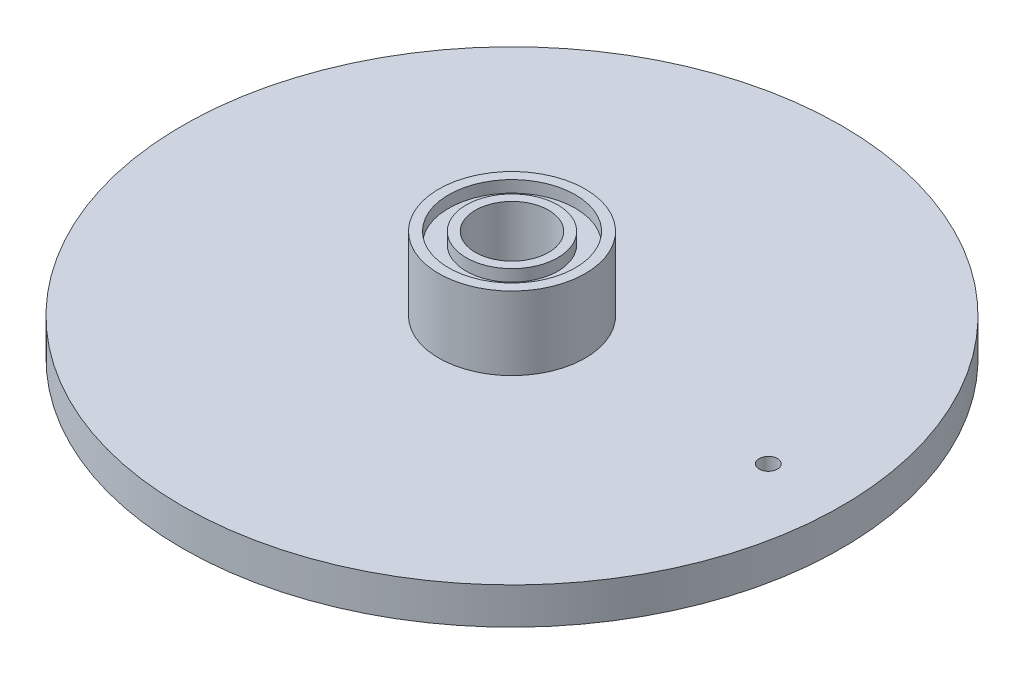
from build123d import *

# Parameters (mm, degrees)
F_1_8_0_125_DIAMETER_HOLE1_D     = 3.175
F_1_8_0_125_DIAMETER_HOLE1_DEPTH = 3.175
F_1_8_0_125_DIAMETER_HOLE1_TIP   = 0.953866233


with BuildPart() as part:
    # Sketch1 → Revolve1 (revolve)
    with BuildSketch(Plane.XY, mode=Mode.PRIVATE) as revolve1_sk:
        Polygon((-6.35, 0), (-52.5145, 0), (-52.5145, 2.032), (-55.5625, 2.032), (-55.5625, 0), (-57.15, 0), (-57.15, 6.35), (-12.7, 6.35), (-12.7, 19.05), (-10.9855, 19.05), (-10.9855, 17.018), (-7.9375, 17.018), (-7.9375, 19.05), (-6.35, 19.05), (-6.35, 9.398), (-8.382, 9.398), (-8.382, 6.35), (-6.35, 6.35), align=None)
    revolve(revolve1_sk.sketch.rotate(Axis((0, 0, 0), (0, 1, 0)), 270), axis=Axis((0, 0, 0), (0, 1, 0)))

    # 1/8 (0.125) Diameter Hole1
    with Locations(Plane(origin=(0, 6.35, 0), x_dir=(1, 0, 0), z_dir=(0, 1, 0))):
        with Locations((44.45, 0)):
            Hole(F_1_8_0_125_DIAMETER_HOLE1_D / 2, depth=F_1_8_0_125_DIAMETER_HOLE1_DEPTH)
            with Locations((0, 0, -(F_1_8_0_125_DIAMETER_HOLE1_DEPTH + F_1_8_0_125_DIAMETER_HOLE1_TIP / 2))):  # 118° drill point
                Cone(0, F_1_8_0_125_DIAMETER_HOLE1_D / 2, F_1_8_0_125_DIAMETER_HOLE1_TIP, mode=Mode.SUBTRACT)


solid = part.part
